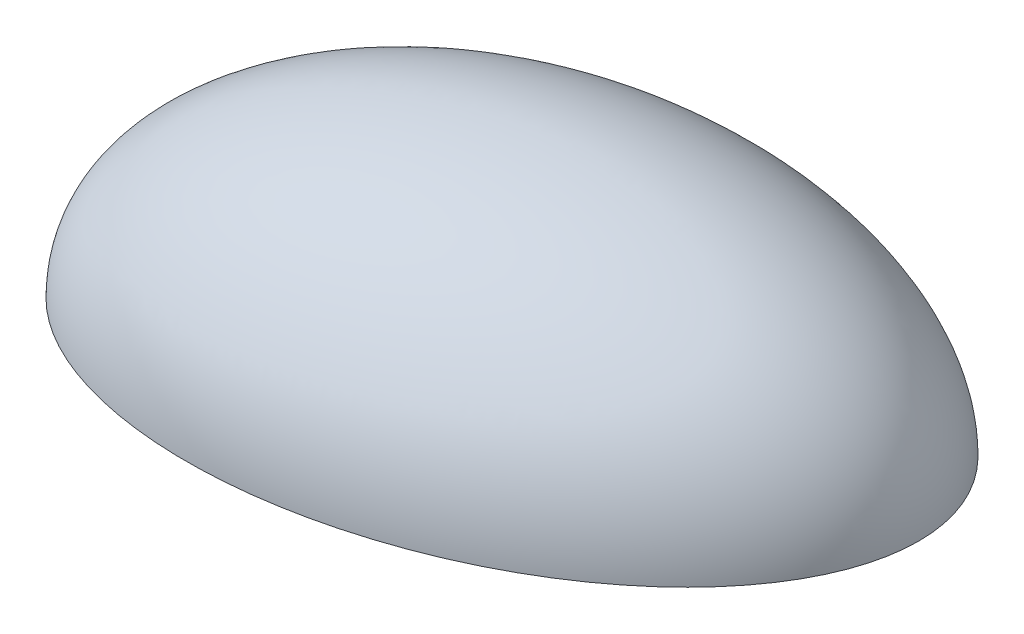
from build123d import *

# Parameters (mm, degrees)
R_VOLUTION1_ANGLE = 180


with BuildPart() as part:
    # Esquisse1 → Révolution1 (revolve)
    with BuildSketch(Plane(origin=(0, 0, 0), x_dir=(1, 0, 0), z_dir=(0, 1, 0))):
        with BuildLine():
            Line((-16.268046036, -4.934640631), (-19.13887769, -5.805459566))
            add(Edge.make_bspline(
                [(19.13887769, 5.805459566), (15.510465461, 17.767258122), (-3.628412229, 11.961798556), (-22.767289919, 6.15633899), (-19.13887769, -5.805459566)],
                knots=[0, 0, 0, 1.570796327, 1.570796327, 3.141592654, 3.141592654, 3.141592654], degree=2, weights=[1, 0.707106781, 1, 0.707106781, 1]))
            Line((19.13887769, 5.805459566), (16.268046036, 4.934640631))
            add(Edge.make_bspline(
                [(16.268046036, 4.934640631), (13.510452743, 14.025607534), (-2.757593294, 9.090966903), (-19.02563933, 4.156326272), (-16.268046036, -4.934640631)],
                knots=[0, 0, 0, 1.570796327, 1.570796327, 3.141592654, 3.141592654, 3.141592654], degree=2, weights=[1, 0.707106781, 1, 0.707106781, 1]))
        make_face()
    revolve(axis=Axis((-19.13887769, 0, 5.805459566), (0.9569438844941944, 0, -0.29027297829657195)), revolution_arc=R_VOLUTION1_ANGLE)


solid = part.part
